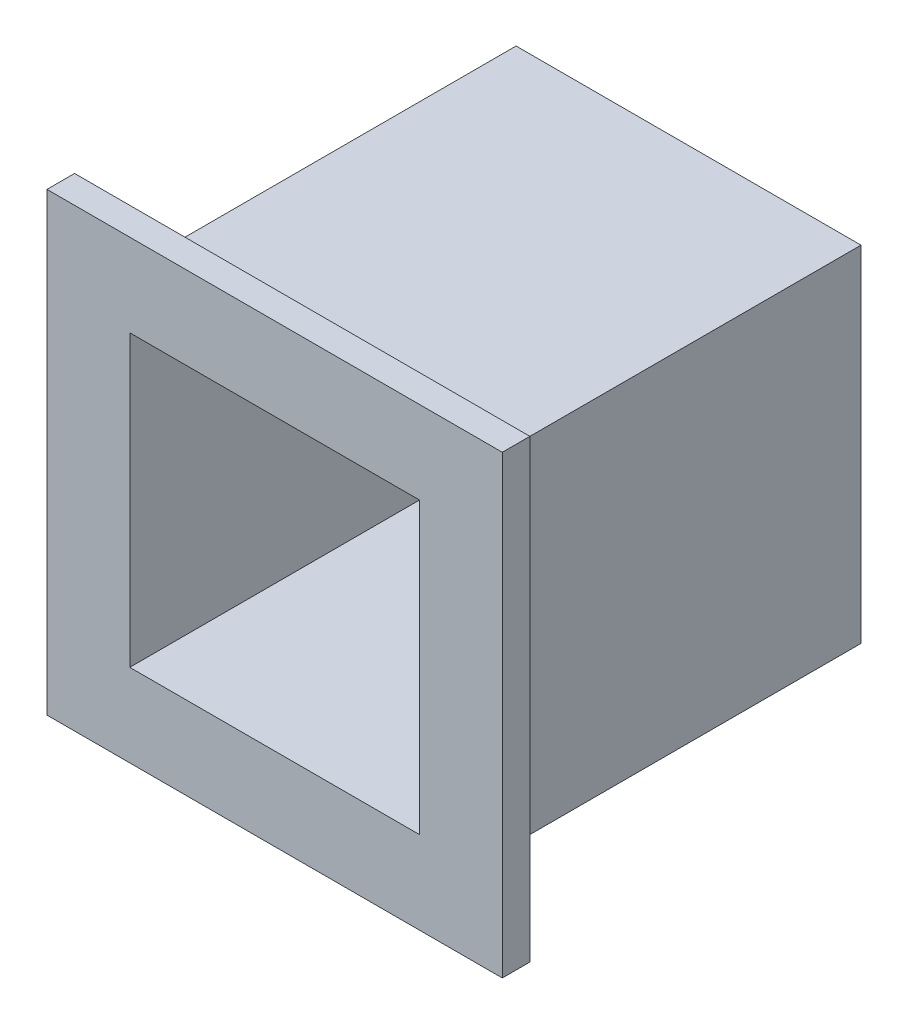
from build123d import *

# Parameters (mm, degrees)
SKETCH1_W           = 12.5
SKETCH1_H           = 12.5
BOSS_EXTRUDE1_DEPTH = 15
SHELL3_T            = -1
SKETCH2_W           = 16.5
SKETCH2_H           = 16.5
SKETCH2_W_2         = 12.5
SKETCH2_H_2         = 12.5
BOSS_EXTRUDE2_DEPTH = 1


with BuildPart() as part:
    # Sketch1 → Boss-Extrude1 (new body)
    with BuildSketch(Plane.XY):
        Rectangle(SKETCH1_W, SKETCH1_H)
    extrude(amount=BOSS_EXTRUDE1_DEPTH)

    # Shell3
    shell3_openings = [part.faces().sort_by_distance(p)[0] for p in [
        (0, 0, 15),
    ]]
    offset(amount=SHELL3_T, openings=shell3_openings, kind=Kind.INTERSECTION)

    # Sketch2 → Boss-Extrude2 (add)
    with BuildSketch(Plane.XY.offset(15)):
        Rectangle(SKETCH2_W, SKETCH2_H)
        Rectangle(SKETCH2_W_2, SKETCH2_H_2, mode=Mode.SUBTRACT)
    extrude(amount=-BOSS_EXTRUDE2_DEPTH)


solid = part.part
